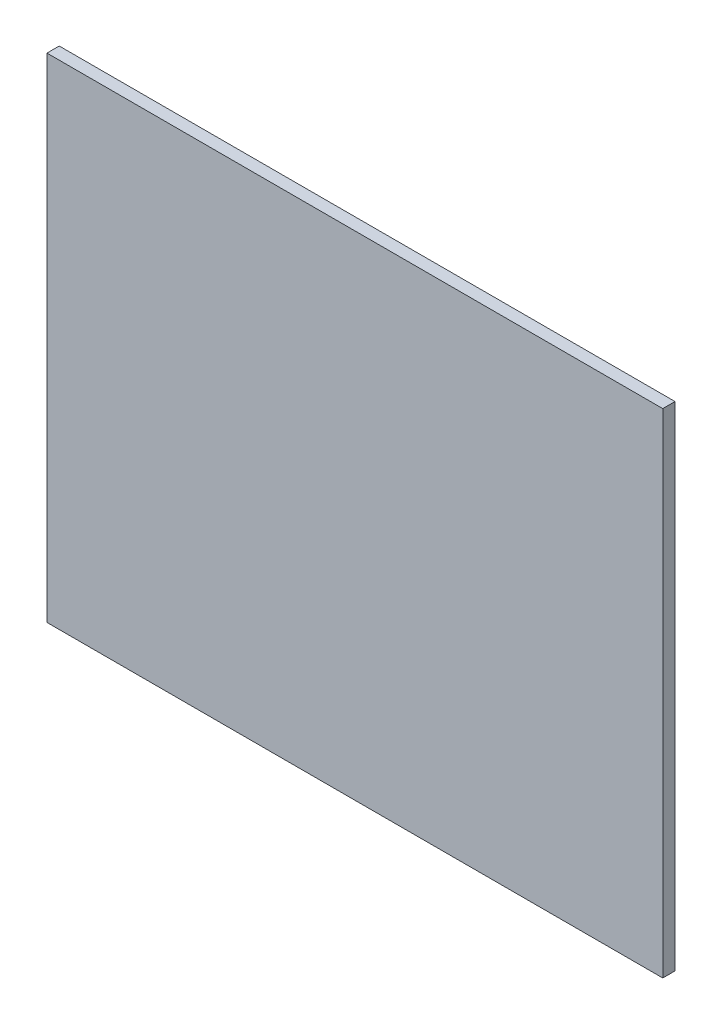
from build123d import *

# Parameters (mm, degrees)
SKETCH5_W           = 251
SKETCH5_H           = 201
BOSS_EXTRUDE2_DEPTH = 5


with BuildPart() as part:
    # Sketch5 → Boss-Extrude2 (new body)
    with BuildSketch(Plane.XY):
        with Locations((125.5, 100.5)):
            Rectangle(SKETCH5_W, SKETCH5_H)
    extrude(amount=BOSS_EXTRUDE2_DEPTH)


solid = part.part
